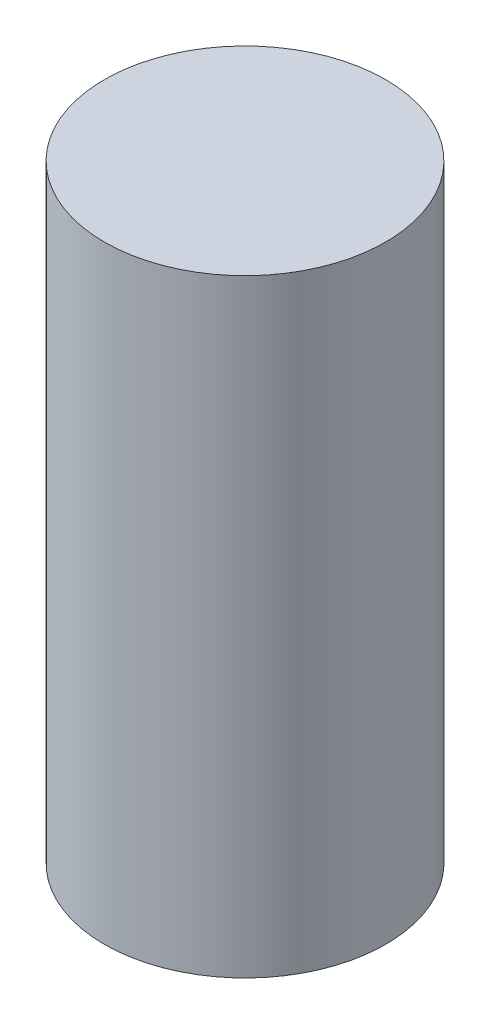
from build123d import *

# Parameters (mm, degrees)
SKETCH1_R           = 6.8
BOSS_EXTRUDE1_DEPTH = 29.4


with BuildPart() as part:
    # Sketch1 → Boss-Extrude1 (new body)
    with BuildSketch(Plane(origin=(0, 0, 0), x_dir=(1, 0, 0), z_dir=(0, 1, 0))):
        with Locations(Location((0, 0, 0), (0, 0, 270))):
            Circle(SKETCH1_R)
    extrude(amount=BOSS_EXTRUDE1_DEPTH)


solid = part.part
